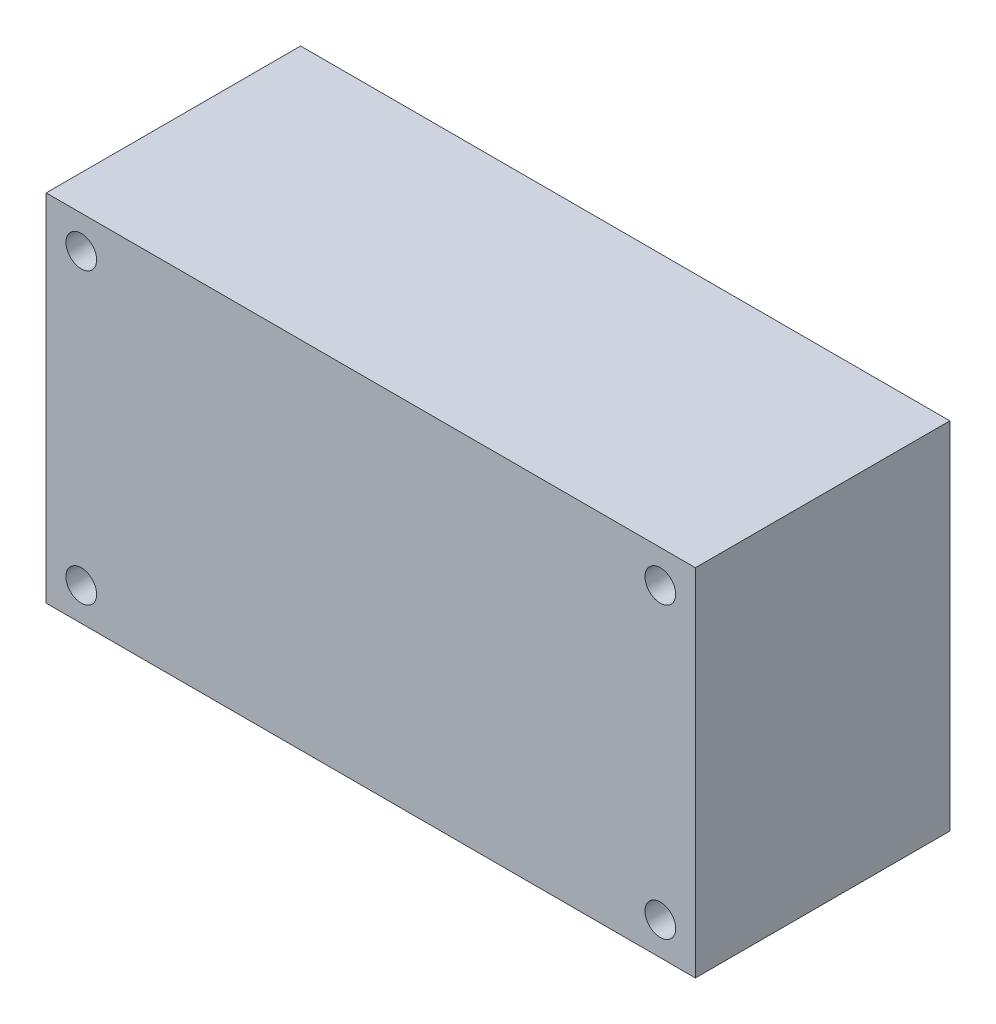
from build123d import *

# Parameters (mm, degrees)
SKETCH_1_W      = 74
SKETCH_1_H      = 40.5
SKETCH_1_R      = 1.75
EXTRUDE_1_DEPTH = 29


with BuildPart() as part:
    # 草圖1 → 伸長1 (new body)
    with BuildSketch(Plane.XY):
        Rectangle(SKETCH_1_W, SKETCH_1_H)
        with Locations(Location((-33, 16.5, 0), (0, 0, 180))):
            Circle(SKETCH_1_R, mode=Mode.SUBTRACT)
        with Locations(Location((-33, -16.5, 0), (0, 0, 180))):
            Circle(SKETCH_1_R, mode=Mode.SUBTRACT)
        with Locations(Location((33, -16.5, 0), (0, 0, 180))):
            Circle(SKETCH_1_R, mode=Mode.SUBTRACT)
        with Locations(Location((33, 16.5, 0), (0, 0, 180))):
            Circle(SKETCH_1_R, mode=Mode.SUBTRACT)
    extrude(amount=EXTRUDE_1_DEPTH)


solid = part.part
